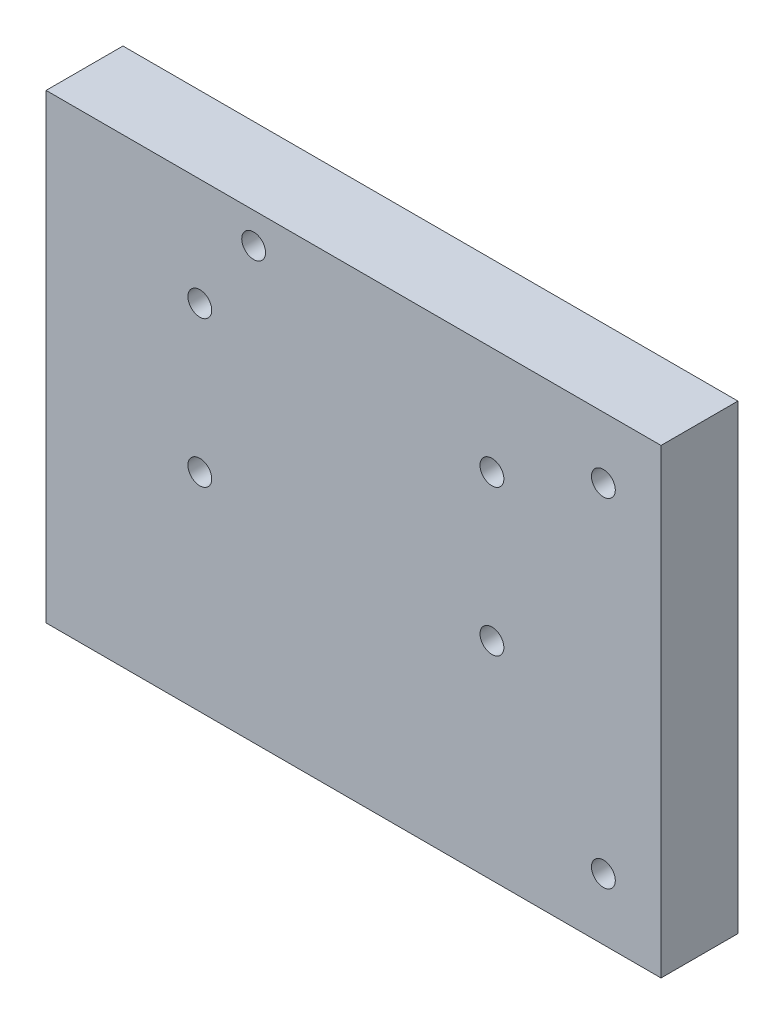
from build123d import *

# Parameters (mm, degrees)
SKETCH1_W           = 80
SKETCH1_H           = 60
SKETCH1_R           = 1.55
BOSS_EXTRUDE1_DEPTH = 10
CUT_EXTRUDE1_REACH  = 52.99
SKETCH2_R           = 1.55
CUT_EXTRUDE2_REACH  = 52.99
SKETCH3_R           = 1.55


with BuildPart() as part:
    # Sketch1 → Boss-Extrude1 (new body)
    with BuildSketch(Plane.XY):
        Rectangle(SKETCH1_W, SKETCH1_H)
        with Locations((-20, 16)):
            Circle(SKETCH1_R, mode=Mode.SUBTRACT)
        with Locations((18, 16)):
            Circle(SKETCH1_R, mode=Mode.SUBTRACT)
        with Locations((18, -3)):
            Circle(SKETCH1_R, mode=Mode.SUBTRACT)
        with Locations((-20, -3)):
            Circle(SKETCH1_R, mode=Mode.SUBTRACT)
    extrude(amount=BOSS_EXTRUDE1_DEPTH)

    # Sketch2 → Cut-Extrude1 (cut, up to next)
    with BuildSketch(Plane(origin=(0, 0, 0), x_dir=(-1, 0, 0), z_dir=(0, 0, -1)), mode=Mode.PRIVATE) as cut_extrude1_sk1:
        with Locations((13, 26)):
            Circle(SKETCH2_R)
    cut_extrude1_tool1 = extrude(cut_extrude1_sk1.sketch, amount=-CUT_EXTRUDE1_REACH, mode=Mode.PRIVATE) & part.part
    add(cut_extrude1_tool1.solids().sort_by_distance((-13, 26, 0))[0], mode=Mode.SUBTRACT)

    # Sketch3 → Cut-Extrude2 (cut, up to next)
    with BuildSketch(Plane.XY.offset(10), mode=Mode.PRIVATE) as cut_extrude2_sk1:
        with Locations((32.5, 22)):
            Circle(SKETCH3_R)
    cut_extrude2_tool1 = extrude(cut_extrude2_sk1.sketch, amount=-CUT_EXTRUDE2_REACH, mode=Mode.PRIVATE) & part.part
    # Sketch3 → Cut-Extrude2 (cut, up to next)
    with BuildSketch(Plane.XY.offset(10), mode=Mode.PRIVATE) as cut_extrude2_sk2:
        with Locations((32.5, -22)):
            Circle(SKETCH3_R)
    cut_extrude2_tool2 = extrude(cut_extrude2_sk2.sketch, amount=-CUT_EXTRUDE2_REACH, mode=Mode.PRIVATE) & part.part
    add(cut_extrude2_tool1.solids().sort_by_distance((32.5, 22, 10))[0], mode=Mode.SUBTRACT)
    add(cut_extrude2_tool2.solids().sort_by_distance((32.5, -22, 10))[0], mode=Mode.SUBTRACT)


solid = part.part
